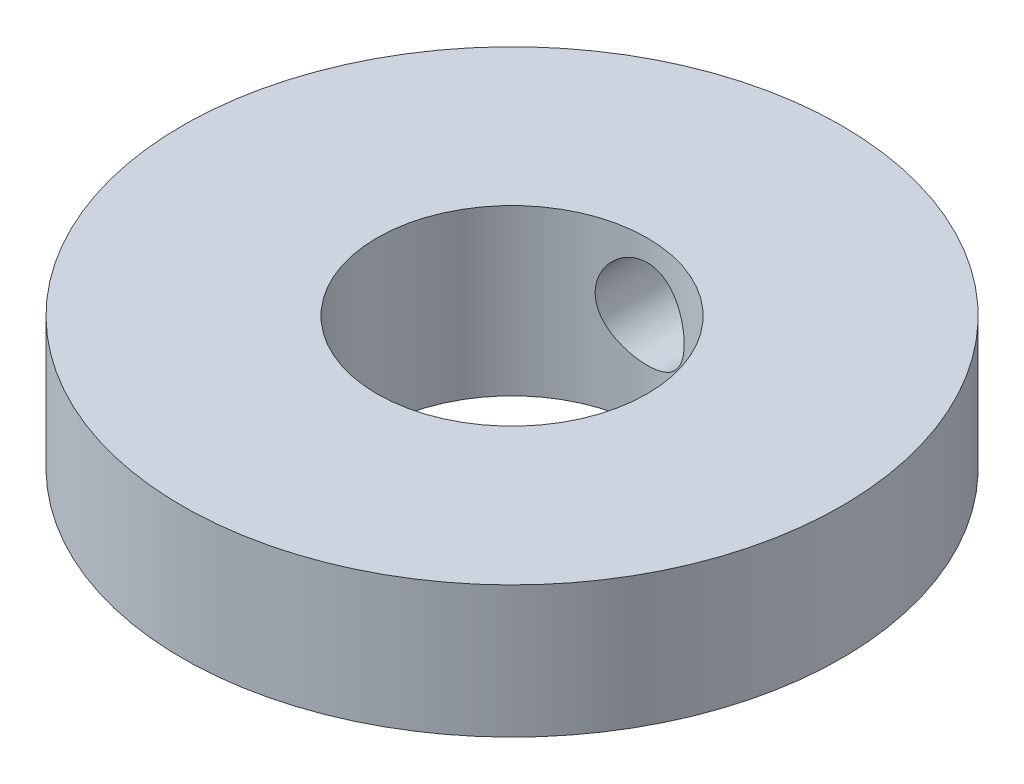
from build123d import *

# Parameters (mm, degrees)
F_2_7_2_7_DIAMETER_HOLE1_REACH  = 24.913
F_2_7_2_7_DIAMETER_HOLE1_BORE_R = 1.35


with BuildPart() as part:
    # Sketch1 → Revolve1 (revolve)
    with BuildSketch(Plane(origin=(0, 0, 0), x_dir=(0, 0, -1), z_dir=(1, 0, 0)), mode=Mode.PRIVATE) as revolve1_sk:
        Polygon((-4.1, 0), (-5, 0), (-6, 1), (-10, 1), (-10, 5), (-4.1, 5), align=None)
    revolve(revolve1_sk.sketch.rotate(Axis((0, 0, 0), (0, 1, 0)), 180), axis=Axis((0, 0, 0), (0, 1, 0)))

    # Ø2.7 (2.7) Diameter Hole1 bore → Ø2.7 (2.7) Diameter Hole1 (cut, up to next)
    with BuildSketch(Plane(origin=(0, 0, -10), x_dir=(-1, 0, 0), z_dir=(0, 0, -1)), mode=Mode.PRIVATE) as f_2_7_2_7_diameter_hole1_sk1:
        with Locations((0, 3)):
            Circle(F_2_7_2_7_DIAMETER_HOLE1_BORE_R)
    f_2_7_2_7_diameter_hole1_tool1 = extrude(f_2_7_2_7_diameter_hole1_sk1.sketch, amount=-F_2_7_2_7_DIAMETER_HOLE1_REACH, mode=Mode.PRIVATE) & part.part
    add(f_2_7_2_7_diameter_hole1_tool1.solids().sort_by_distance((0, 3, -10))[0], mode=Mode.SUBTRACT)


solid = part.part
